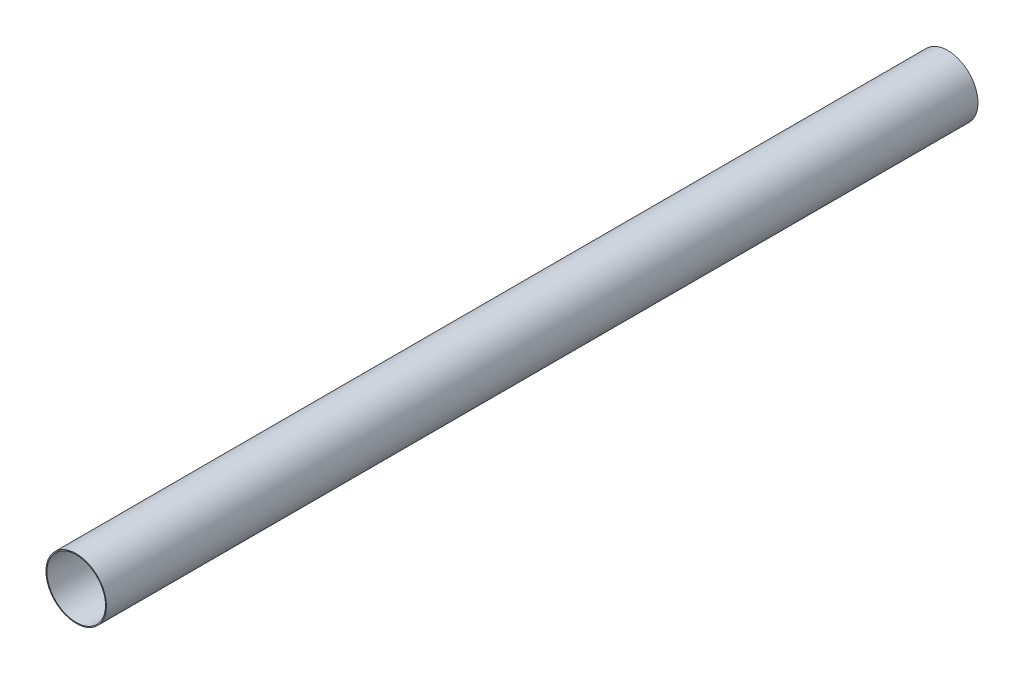
from build123d import *

# Parameters (mm, degrees)
SKETCH1_R           = 51.1175
SKETCH1_R_2         = 49.53
BOSS_EXTRUDE1_DEPTH = 1473.2


with BuildPart() as part:
    # Sketch1 → Boss-Extrude1 (new body)
    with BuildSketch(Plane.XY):
        Circle(SKETCH1_R)
        Circle(SKETCH1_R_2, mode=Mode.SUBTRACT)
    extrude(amount=BOSS_EXTRUDE1_DEPTH)


solid = part.part
